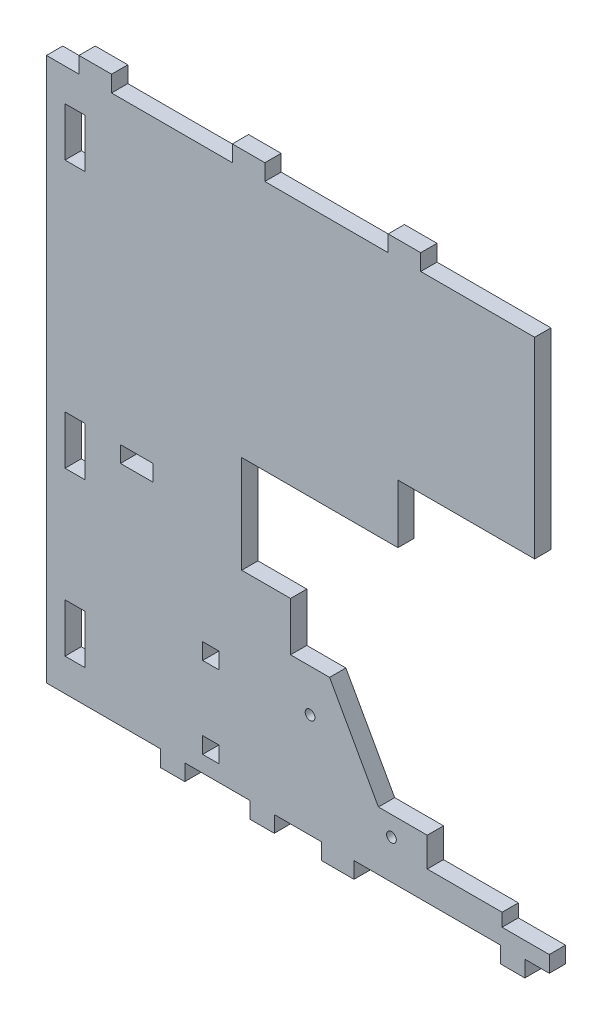
from build123d import *

# Parameters (mm, degrees)
ESQUISSE1_R             = 1.5
BOSS_EXTRU_1_DEPTH      = 5
ESQUISSE2_W             = 6.138933528
ESQUISSE2_H             = 15
ESQUISSE2_W_2           = 5
ESQUISSE2_H_2           = 5
BOSS_EXTRU_2_DEPTH      = 5
ESQUISSE3_W             = 10
ESQUISSE3_H             = 5
BOSS_EXTRU_3_DEPTH      = 5
ESQUISSE4_W             = 10.001975045
ESQUISSE4_H             = 5
ENL_V_MAT_EXTRU_1_DEPTH = 10


with BuildPart() as part:
    # Esquisse1 → Boss.-Extru.1 (new body)
    with BuildSketch(Plane.XY):
        Polygon((0, 0), (37, 0), (37, 18), (27, 18), (12, 45), (0, 45), align=None)
        with Locations((6, 32)):
            Circle(ESQUISSE1_R, mode=Mode.SUBTRACT)
        with Locations((31, 12)):
            Circle(ESQUISSE1_R, mode=Mode.SUBTRACT)
    extrude(amount=BOSS_EXTRU_1_DEPTH)

    # Esquisse2 → Boss.-Extru.2 (add)
    # profile 1 of 2: a face of its own
    with BuildSketch(Plane.XY.offset(5)):
        Polygon((37, 0), (37, 18), (42, 18), (42, 9), (65, 9), (65, 5), (79.5, 5), (79.5, 0), (72, 0), (72, -5), (64.5, -5), (64.5, 0), align=None)
    # profile 2 of 2: a face of its own
    with BuildSketch(Plane.XY.offset(5)):
        Polygon((0, 0), (-5, 0), (-5, -5), (-12.5, -5), (-12.5, 0), (-32.5, 0), (-32.5, -5), (-40, -5), (-40, 0), (-75, 0), (-75, 167), (-65, 167), (-65, 172), (-55, 172), (-55, 167), (30, 167), (30, 172), (40, 172), (40, 167), (75, 167), (75, 108), (33, 108), (33, 90), (-15, 90), (-15, 60), (0, 60), align=None)
        with Locations((-66.228617731, 17.5)):
            Rectangle(ESQUISSE2_W, ESQUISSE2_H, mode=Mode.SUBTRACT)
        with Locations((-66.228617731, 67.5)):
            Rectangle(ESQUISSE2_W, ESQUISSE2_H, mode=Mode.SUBTRACT)
        with Locations((-66.228617731, 149.5)):
            Rectangle(ESQUISSE2_W, ESQUISSE2_H, mode=Mode.SUBTRACT)
        with Locations((-24.5, 7.5)):
            Rectangle(ESQUISSE2_W_2, ESQUISSE2_H_2, mode=Mode.SUBTRACT)
        with Locations((-24.5, 32.5)):
            Rectangle(ESQUISSE2_W_2, ESQUISSE2_H_2, mode=Mode.SUBTRACT)
    extrude(amount=-BOSS_EXTRU_2_DEPTH)

    # Esquisse3 → Boss.-Extru.3 (add)
    with BuildSketch(Plane(origin=(0, 0, 0), x_dir=(-1, 0, 0), z_dir=(0, 0, -1))):
        with Locations((-14.5, -2.5)):
            Rectangle(ESQUISSE3_W, ESQUISSE3_H)
        with Locations((12.893402511, 169.5)):
            Rectangle(ESQUISSE3_W, ESQUISSE3_H)
    extrude(amount=-BOSS_EXTRU_3_DEPTH)

    # Esquisse4 → Enlèv. mat.-Extru.1 (cut)
    with BuildSketch(Plane(origin=(0, 0, 0), x_dir=(-1, 0, 0), z_dir=(0, 0, -1))):
        with Locations((47.271024733, 72.3)):
            Rectangle(ESQUISSE4_W, ESQUISSE4_H)
    extrude(amount=-ENL_V_MAT_EXTRU_1_DEPTH, mode=Mode.SUBTRACT)


solid = part.part
